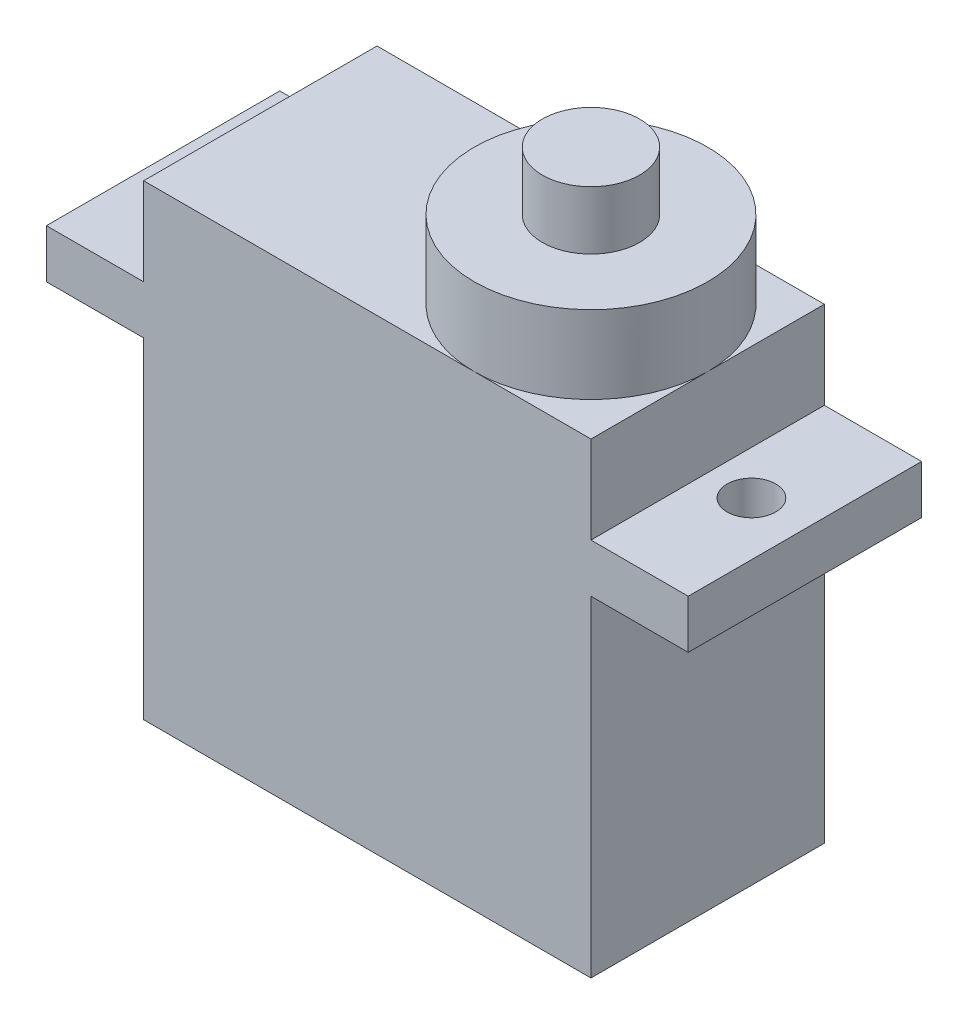
from build123d import *

# Parameters (mm, degrees)
SKETCH_1_W          = 23
SKETCH_1_H          = 12
EXTRUDE_1_DEPTH     = 24
SKETCH_2_W          = 12
SKETCH_2_H          = 2.5
EXTRUDE_2_DEPTH     = 5
SKETCH_3_W          = 12
SKETCH_3_H          = 2.5
EXTRUDE_3_DEPTH     = 5
SKETCH_4_R          = 6
EXTRUDE_4_DEPTH     = 4
SKETCH_5_R          = 2.5
EXTRUDE_5_DEPTH     = 3
SKETCH_6_R          = 1.25
CUT_EXTRUDE_1_DEPTH = 3


with BuildPart() as part:
    # 草图1 → 凸台-拉伸1 (new body)
    with BuildSketch(Plane(origin=(0, 0, 0), x_dir=(1, 0, 0), z_dir=(0, 1, 0))):
        Rectangle(SKETCH_1_W, SKETCH_1_H)
    extrude(amount=EXTRUDE_1_DEPTH)

    # 草图2 → 凸台-拉伸2 (add)
    with BuildSketch(Plane(origin=(11.5, 0, 0), x_dir=(0, 0, -1), z_dir=(1, 0, 0))):
        with Locations((0, 18.25)):
            Rectangle(SKETCH_2_W, SKETCH_2_H)
    extrude(amount=EXTRUDE_2_DEPTH)

    # 草图3 → 凸台-拉伸3 (add)
    with BuildSketch(Plane.ZY.offset(11.5)):
        with Locations((0, 18.25)):
            Rectangle(SKETCH_3_W, SKETCH_3_H)
    extrude(amount=EXTRUDE_3_DEPTH)

    # 草图4 → 凸台-拉伸4 (add)
    with BuildSketch(Plane(origin=(0, 24, 0), x_dir=(1, 0, 0), z_dir=(0, 1, 0))):
        with Locations(Location((5.5, 0, 0), (0, 0, 270))):
            Circle(SKETCH_4_R)
    extrude(amount=EXTRUDE_4_DEPTH)

    # 草图5 → 凸台-拉伸5 (add)
    with BuildSketch(Plane(origin=(0, 28, 0), x_dir=(1, 0, 0), z_dir=(0, 1, 0))):
        with Locations(Location((5.5, 0, 0), (0, 0, 270))):
            Circle(SKETCH_5_R)
    extrude(amount=EXTRUDE_5_DEPTH)

    # 草图6 → 切除-拉伸1 (cut)
    with BuildSketch(Plane(origin=(0, 19.5, 0), x_dir=(1, 0, 0), z_dir=(0, 1, 0))):
        with Locations(Location((13.75, 0, 0), (0, 0, 270))):
            Circle(SKETCH_6_R)
        with Locations(Location((-13.75, 0, 0), (0, 0, 270))):
            Circle(SKETCH_6_R)
    extrude(amount=-CUT_EXTRUDE_1_DEPTH, mode=Mode.SUBTRACT)


solid = part.part
